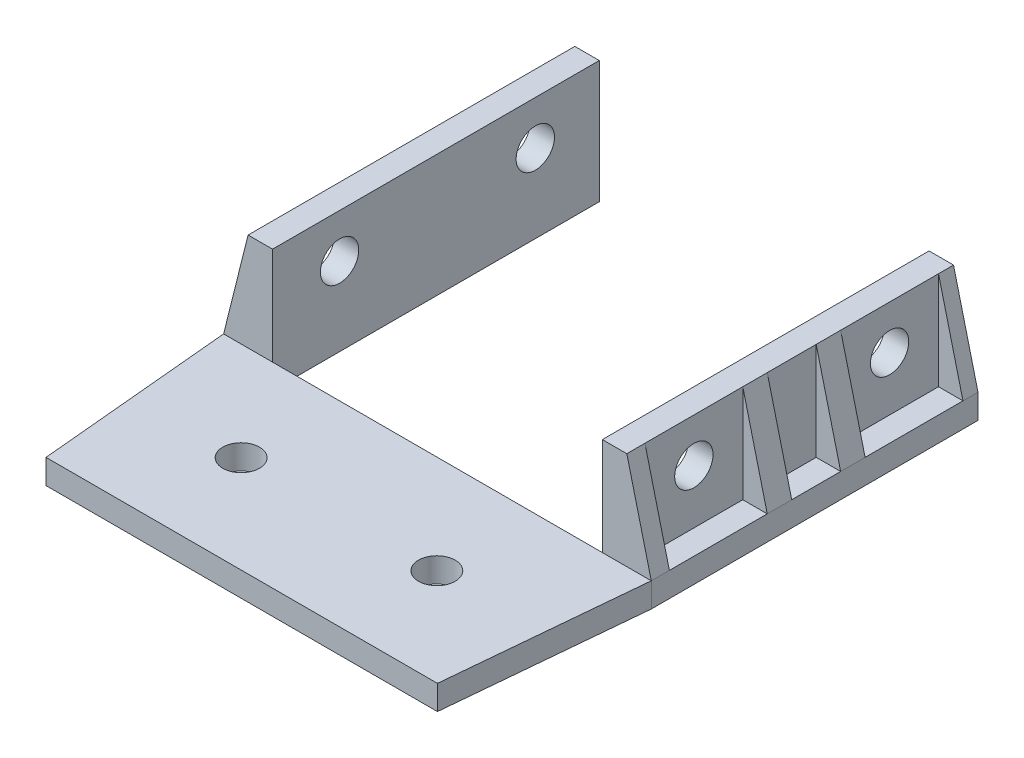
from build123d import *

# Parameters (mm, degrees)
BOSS_EXTRUDE1_DEPTH            = 3.175
F_3_16_0_1875_DIAMETER_HOLE1_D = 4.7625
SKETCH6_W                      = 3.175
SKETCH6_H                      = 12.7
BOSS_EXTRUDE2_DEPTH            = 12.7
F_9_0_196_DIAMETER_HOLE1_D     = 4.9784
SKETCH9_W                      = 6.35
SKETCH9_H                      = 2.35
SKETCH9_H_2                    = 3.175
SKETCH9_H_3                    = 1.95
BOSS_EXTRUDE3_DEPTH            = 12.7
CUT_EXTRUDE1_DEPTH             = 67.530730681
SKETCH11_W                     = 3.175
SKETCH11_H                     = 6.35
BOSS_EXTRUDE4_DEPTH            = 12.7


with BuildPart() as part:
    # Sketch1 → Boss-Extrude1 (new body)
    with BuildSketch(Plane(origin=(0, 0, 0), x_dir=(1, 0, 0), z_dir=(0, 1, 0))):
        Polygon((0.4, -0.4), (0.4, 42), (6.75, 42), (6.75, -0.4), (4.4, -25.8), (-46.4, -25.8), (-48.75, -0.4), (-48.75, 42), (-42.4, 42), (-42.4, -0.4), align=None)
    extrude(amount=BOSS_EXTRUDE1_DEPTH)

    # 3/16 (0.1875) Diameter Hole1 (through all)
    with Locations(Plane(origin=(0, 3.175, 0), x_dir=(1, 0, 0), z_dir=(0, 1, 0))):
        with Locations((-33.7, -13.178131577), (-8.3, -13.178131577)):
            Hole(F_3_16_0_1875_DIAMETER_HOLE1_D / 2)

    # Sketch6 → Boss-Extrude2 (add)
    with BuildSketch(Plane(origin=(0, 3.175, 0), x_dir=(1, 0, 0), z_dir=(0, 1, 0))):
        with Locations((-43.9875, 8.3)):
            Rectangle(SKETCH6_W, SKETCH6_H)
        with Locations((-43.9875, 33.7)):
            Rectangle(SKETCH6_W, SKETCH6_H)
        with Locations((1.9875, 8.3)):
            Rectangle(SKETCH6_W, SKETCH6_H)
        with Locations((1.9875, 33.7)):
            Rectangle(SKETCH6_W, SKETCH6_H)
    extrude(amount=BOSS_EXTRUDE2_DEPTH)

    # #9 (0.196) Diameter Hole1 (through all)
    with Locations(Plane.ZY.offset(45.575)):
        with Locations((-8.3, 10.1854), (-33.7, 10.1854)):
            Hole(F_9_0_196_DIAMETER_HOLE1_D / 2)

    # Sketch9 → Boss-Extrude3 (add)
    with BuildSketch(Plane(origin=(0, 3.175, 0), x_dir=(1, 0, 0), z_dir=(0, 1, 0))):
        with Locations((-45.575, 0.775)):
            Rectangle(SKETCH9_W, SKETCH9_H)
        with Locations((3.575, 0.775)):
            Rectangle(SKETCH9_W, SKETCH9_H)
        with Locations((3.575, 16.2375)):
            Rectangle(SKETCH9_W, SKETCH9_H_2)
        with Locations((-45.575, 16.2375)):
            Rectangle(SKETCH9_W, SKETCH9_H_2)
        with Locations((3.575, 25.7625)):
            Rectangle(SKETCH9_W, SKETCH9_H_2)
        with Locations((3.575, 41.025)):
            Rectangle(SKETCH9_W, SKETCH9_H_3)
        with Locations((-45.575, 41.025)):
            Rectangle(SKETCH9_W, SKETCH9_H_3)
        with Locations((-45.575, 25.7625)):
            Rectangle(SKETCH9_W, SKETCH9_H_2)
    extrude(amount=BOSS_EXTRUDE3_DEPTH)

    # Sketch10 → Cut-Extrude1 (cut, through all)
    with BuildSketch(Plane.XY.offset(0.4)):
        Polygon((-48.75, 3.175), (-45.575, 15.875), (-48.75, 15.875), align=None)
        Polygon((6.75, 3.175), (3.575, 15.875), (6.75, 15.875), align=None)
    extrude(amount=-CUT_EXTRUDE1_DEPTH, mode=Mode.SUBTRACT)

    # Sketch11 → Boss-Extrude4 (add)
    with BuildSketch(Plane(origin=(0, 3.175, 0), x_dir=(1, 0, 0), z_dir=(0, 1, 0))):
        with Locations((-43.9875, 21)):
            Rectangle(SKETCH11_W, SKETCH11_H)
        with Locations((1.9875, 21)):
            Rectangle(SKETCH11_W, SKETCH11_H)
    extrude(amount=BOSS_EXTRUDE4_DEPTH)


solid = part.part
